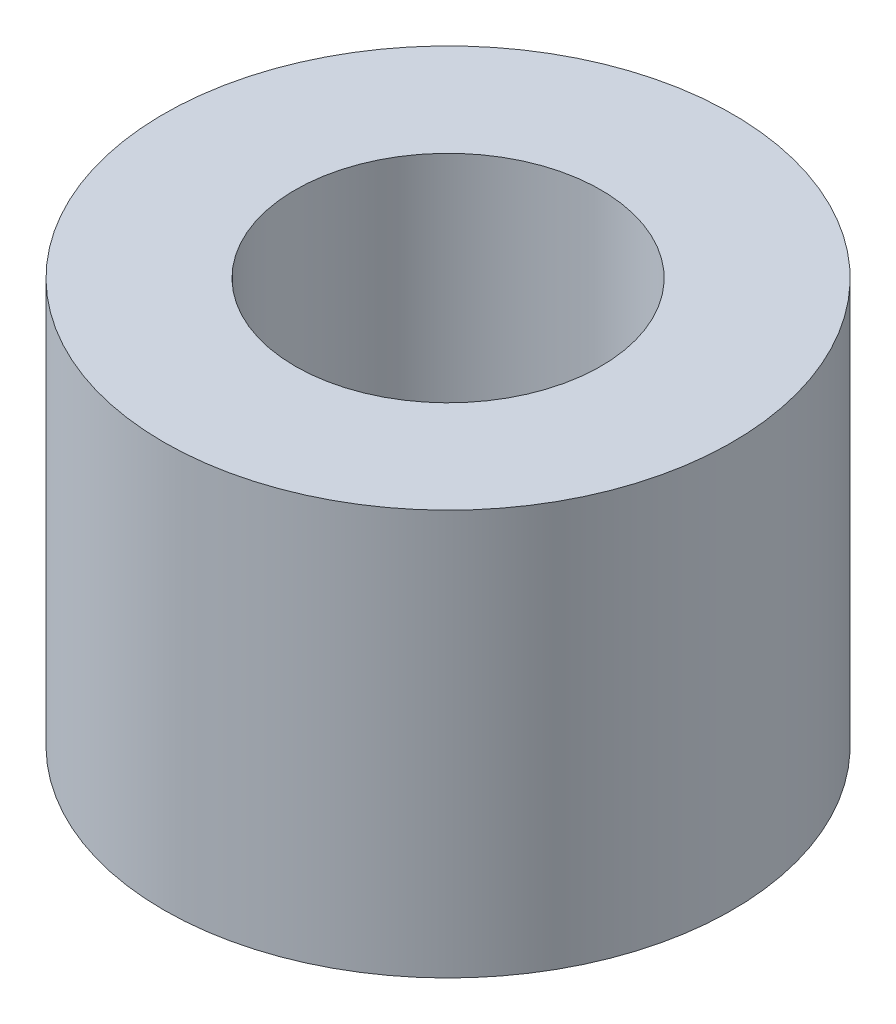
from build123d import *

# Parameters (mm, degrees)
SPACER_SKETCH_R   = 4
SPACER_SKETCH_R_2 = 2.15
SPACER_DEPTH      = 2.85


with BuildPart() as part:
    # Spacer Sketch → Spacer (new, symmetric)
    with BuildSketch(Plane(origin=(0, 9.225, 0), x_dir=(1, 0, 0), z_dir=(0, 1, 0))):
        with Locations((0, -13.44)):
            Circle(SPACER_SKETCH_R)
        with Locations((0, -13.44)):
            Circle(SPACER_SKETCH_R_2, mode=Mode.SUBTRACT)
    extrude(amount=SPACER_DEPTH, both=True)


solid = part.part
